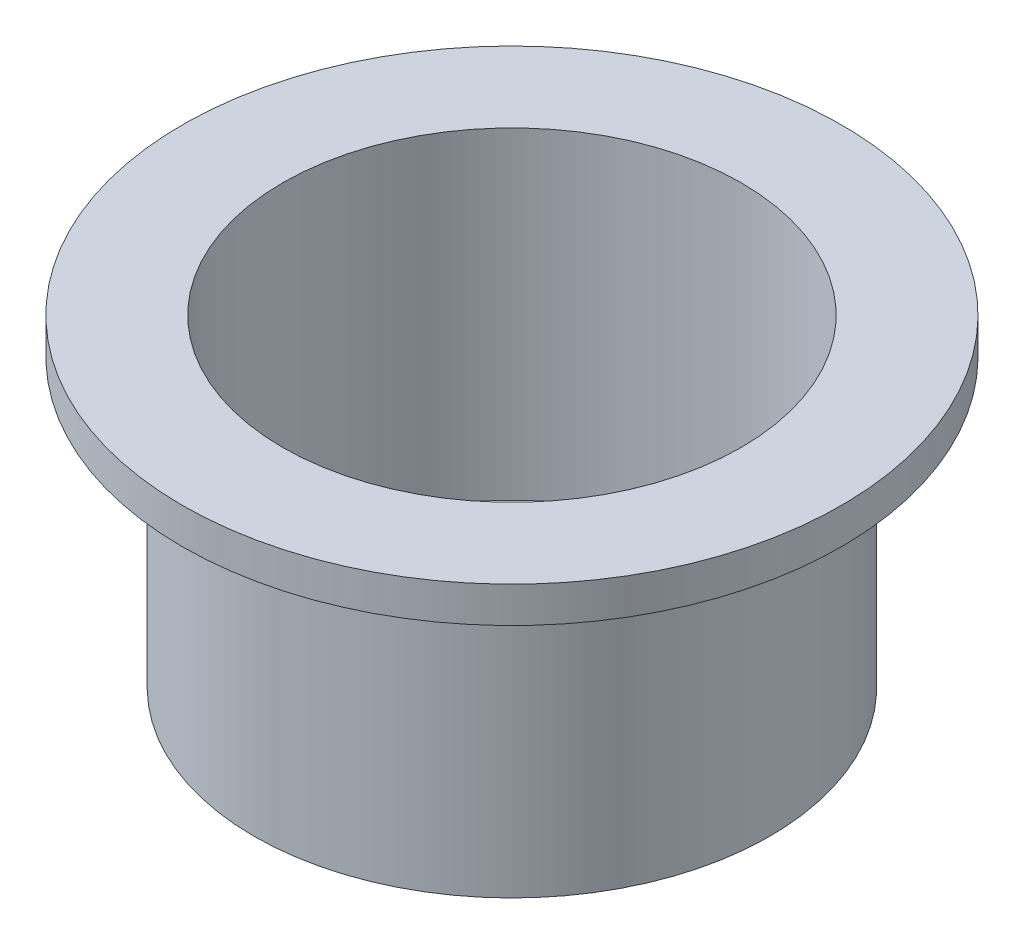
from build123d import *

# Parameters (mm, degrees)
SKETCH1_R           = 11.43
SKETCH1_R_2         = 10.16
BOSS_EXTRUDE1_DEPTH = 12.7
SKETCH2_R           = 14.605
SKETCH2_R_2         = 10.16
BOSS_EXTRUDE2_DEPTH = 1.5875


with BuildPart() as part:
    # Sketch1 → Boss-Extrude1 (new body)
    with BuildSketch(Plane(origin=(0, 0, 0), x_dir=(1, 0, 0), z_dir=(0, 1, 0))):
        with Locations(Location((0, 0, 0), (0, 0, 270))):
            Circle(SKETCH1_R)
        with Locations(Location((0, 0, 0), (0, 0, 270))):
            Circle(SKETCH1_R_2, mode=Mode.SUBTRACT)
    extrude(amount=BOSS_EXTRUDE1_DEPTH)

    # Sketch2 → Boss-Extrude2 (add)
    with BuildSketch(Plane(origin=(0, 12.7, 0), x_dir=(1, 0, 0), z_dir=(0, 1, 0))):
        with Locations(Location((0, 0, 0), (0, 0, 270))):
            Circle(SKETCH2_R)
        with Locations(Location((0, 0, 0), (0, 0, 270))):
            Circle(SKETCH2_R_2, mode=Mode.SUBTRACT)
    extrude(amount=BOSS_EXTRUDE2_DEPTH)


solid = part.part
